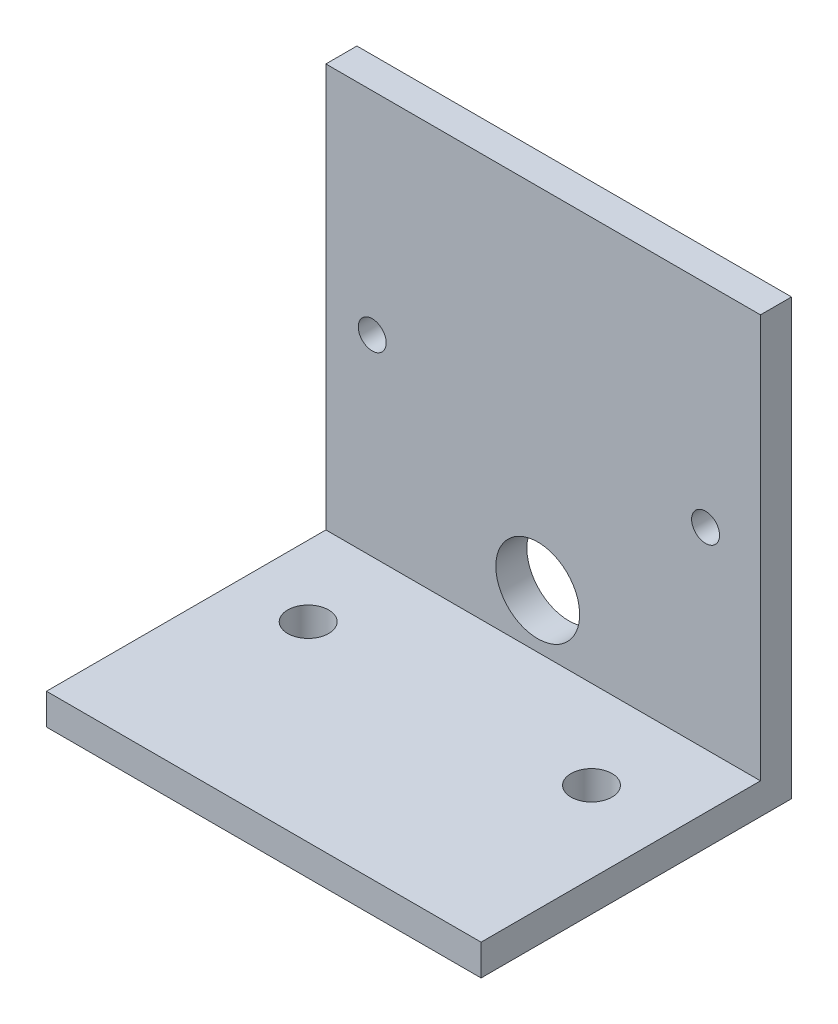
from build123d import *

# Parameters (mm, degrees)
ESQUISSE1_W             = 70
ESQUISSE1_H             = 70
BOSS_EXTRU_1_DEPTH      = 50
ESQUISSE2_W             = 123.137615707
ESQUISSE2_H             = 86.86411441
ENL_V_MAT_EXTRU_1_DEPTH = 217
D_GAGEMENT_M41_D        = 4.5
D_GAGEMENT_M121_D       = 13.5
D_GAGEMENT_M61_D        = 6.6


with BuildPart() as part:
    # Esquisse1 → Boss.-Extru.1 (new body)
    with BuildSketch(Plane.XY):
        Rectangle(ESQUISSE1_W, ESQUISSE1_H)
    extrude(amount=BOSS_EXTRU_1_DEPTH)

    # Esquisse2 → Enlèv. mat.-Extru.1 (cut)
    with BuildSketch(Plane(origin=(35, 0, 0), x_dir=(0, 0, -1), z_dir=(1, 0, 0))):
        with Locations((-66.568807854, 13.432057205)):
            Rectangle(ESQUISSE2_W, ESQUISSE2_H)
    extrude(amount=-ENL_V_MAT_EXTRU_1_DEPTH, mode=Mode.SUBTRACT)

    # Dégagement M41 (through all)
    with Locations(Plane(origin=(0, 0, 0), x_dir=(-1, 0, 0), z_dir=(0, 0, -1))):
        with Locations((-26.157577905, 0.946358973), (27.533117647, 0.946358973)):
            Hole(D_GAGEMENT_M41_D / 2)

    # Dégagement M121 (through all)
    with Locations(Plane(origin=(0, 0, 0), x_dir=(-1, 0, 0), z_dir=(0, 0, -1))):
        with Locations((0.875458958, -21.366395267)):
            Hole(D_GAGEMENT_M121_D / 2)

    # Dégagement M61 (through all)
    with Locations(Plane(origin=(0, -30, 0), x_dir=(1, 0, 0), z_dir=(0, 1, 0))):
        with Locations((-23.62027619, -19.231813592), (22.015174003, -19.231813592)):
            Hole(D_GAGEMENT_M61_D / 2)


solid = part.part
